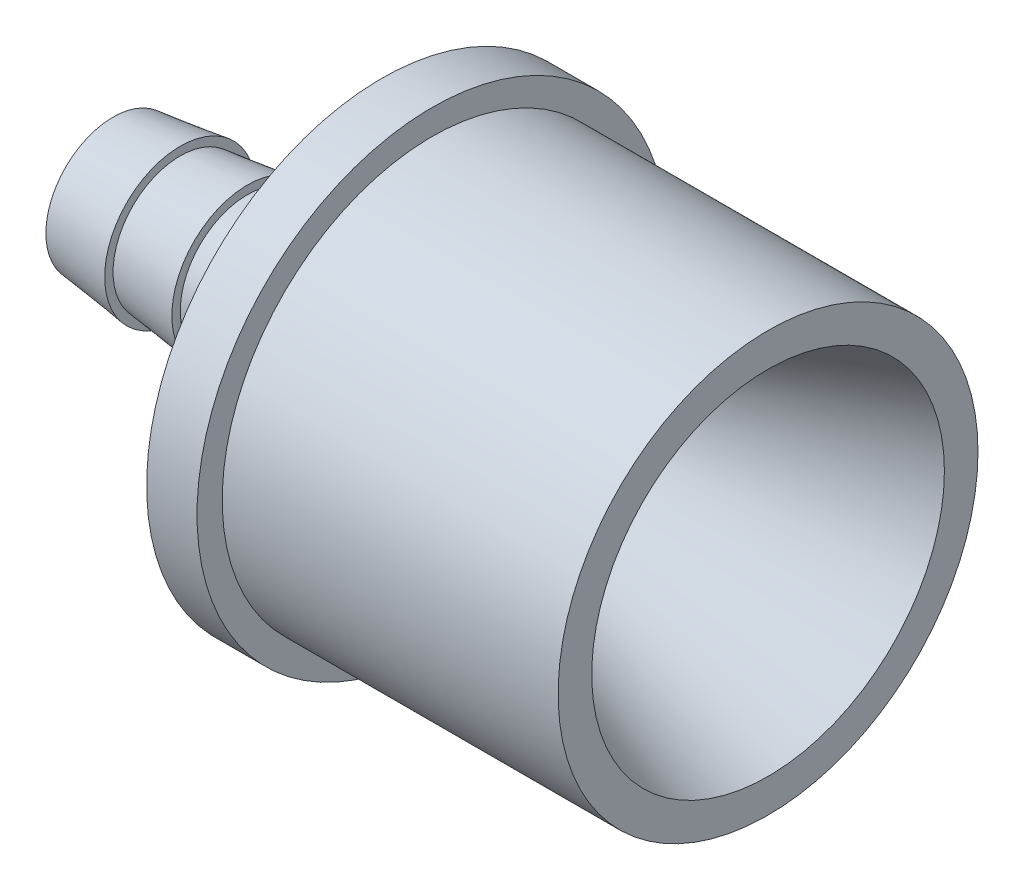
from build123d import *


with BuildPart() as part:
    # Esboço1 → Revolução1 (revolve)
    with BuildSketch(Plane.XY, mode=Mode.PRIVATE) as revolu_o1_sk:
        Polygon((-27.323427807, 14), (-27.323427807, 12.5), (-7.323427807, 12.5), (-7.323427807, 10.5), (-29.115185999, 2.5), (-46.323427807, 2.5), (-46.323427807, 4), (-42.323427807, 4.5), (-42.323427807, 4), (-38.323427807, 4.5), (-38.323427807, 4), (-34.323427807, 4.5), (-34.323427807, 4), (-30.323427807, 4.5), (-30.323427807, 14), align=None)
    revolve(revolu_o1_sk.sketch.rotate(Axis((48.321734693, 0, 0), (-1, 0, 0)), 90), axis=Axis((48.321734693, 0, 0), (-1, 0, 0)))


solid = part.part
